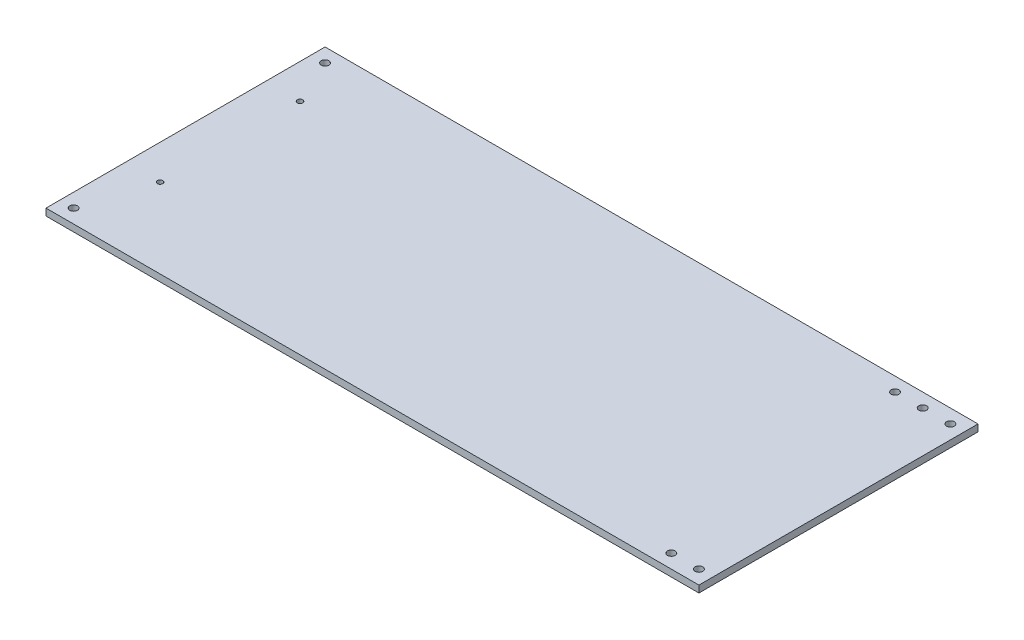
from build123d import *

# Parameters (mm, degrees)
BOSS_EXTRUDE1_START              = 19.05
SKETCH2_W                        = 600
SKETCH2_H                        = 256.45
BOSS_EXTRUDE1_DEPTH              = 6.35
BOSS_EXTRUDE2_START              = 19.05
SKETCH2_4_W                      = 455.092
SKETCH2_4_H                      = 256.45
BOSS_EXTRUDE2_DEPTH              = 6.35
BOSS_EXTRUDE3_START              = 19.05
SKETCH2_5_W                      = 455.092
SKETCH2_5_H                      = 300
BOSS_EXTRUDE3_DEPTH              = 6.35
SKETCH8_W                        = 3.5687
SKETCH8_H                        = 6.35
F_1_4_CLEARANCE_HOLE2_AT_2_COUNT = 2
F_1_4_CLEARANCE_HOLE2_AT_2_PITCH = 231.05
F_1_4_CLEARANCE_HOLE2_AT_3_COUNT = 2
F_1_4_CLEARANCE_HOLE2_AT_3_PITCH = 595.822744195
F_1_4_CLEARANCE_HOLE2_AT_4_COUNT = 2
F_1_4_CLEARANCE_HOLE2_AT_4_PITCH = 619.31354135
F_1_4_CLEARANCE_HOLE2_AT_5_COUNT = 2
F_1_4_CLEARANCE_HOLE2_AT_5_PITCH = 523.8
F_1_4_CLEARANCE_HOLE2_AT_6_COUNT = 2
F_1_4_CLEARANCE_HOLE2_AT_6_PITCH = 549.2
F_1_4_CLEARANCE_HOLE2_AT_7_COUNT = 2
F_1_4_CLEARANCE_HOLE2_AT_7_PITCH = 574.6
SKETCH10_W                       = 3.5687
SKETCH10_H                       = 6.35
F_1_4_CLEARANCE_HOLE3_AT_2_COUNT = 2
F_1_4_CLEARANCE_HOLE3_AT_2_PITCH = 25.4
F_1_4_CLEARANCE_HOLE3_AT_3_COUNT = 2
F_1_4_CLEARANCE_HOLE3_AT_3_PITCH = 50.8
F_1_4_CLEARANCE_HOLE3_AT_4_COUNT = 2
F_1_4_CLEARANCE_HOLE3_AT_4_PITCH = 231.05
F_1_4_CLEARANCE_HOLE3_AT_5_COUNT = 2
F_1_4_CLEARANCE_HOLE3_AT_5_PITCH = 487.872234672
F_1_4_CLEARANCE_HOLE3_AT_6_COUNT = 2
F_1_4_CLEARANCE_HOLE3_AT_6_PITCH = 476.368698976
F_1_4_CLEARANCE_HOLE3_AT_7_COUNT = 2
F_1_4_CLEARANCE_HOLE3_AT_7_PITCH = 429.692
SKETCH12_W                       = 3.5687
SKETCH12_H                       = 6.35
F_1_4_CLEARANCE_HOLE4_AT_2_COUNT = 2
F_1_4_CLEARANCE_HOLE4_AT_2_PITCH = 25.4
F_1_4_CLEARANCE_HOLE4_AT_3_COUNT = 2
F_1_4_CLEARANCE_HOLE4_AT_3_PITCH = 249.2
F_1_4_CLEARANCE_HOLE4_AT_4_COUNT = 2
F_1_4_CLEARANCE_HOLE4_AT_4_PITCH = 496.725130091
F_1_4_CLEARANCE_HOLE4_AT_5_COUNT = 2
F_1_4_CLEARANCE_HOLE4_AT_5_PITCH = 429.692
F_1_4_CLEARANCE_HOLE4_AT_6_COUNT = 2
F_1_4_CLEARANCE_HOLE4_AT_6_PITCH = 430.442069115
SKETCH14_W                       = 2.4892
SKETCH14_H                       = 6.35
F_8_CLEARANCE_HOLE2_AT_2_COUNT   = 2
F_8_CLEARANCE_HOLE2_AT_2_PITCH   = 128.5875
SKETCH16_W                       = 2.4892
SKETCH16_H                       = 6.35
F_8_CLEARANCE_HOLE3_AT_2_COUNT   = 2
F_8_CLEARANCE_HOLE3_AT_2_PITCH   = 128.5875
SKETCH17_R                       = 3.5687
BOSS_EXTRUDE4_DEPTH              = 6.35
FILLET2_R                        = 6.35
SKETCH18_W                       = 152.4
SKETCH18_H                       = 25.4
SKETCH18_R                       = 3.5687
BOSS_EXTRUDE5_DEPTH              = 6.35
SKETCH19_W                       = 25.4
SKETCH19_H                       = 101.6
SKETCH19_R                       = 3.5687
BOSS_EXTRUDE6_DEPTH              = 6.35


with BuildPart() as part:
    # Sketch2 → Boss-Extrude1 (new body)
    with BuildSketch(Plane(origin=(0, 0, 0), x_dir=(1, 0, 0), z_dir=(0, 1, 0)).offset(BOSS_EXTRUDE1_START)):
        with Locations((0, 278.225)):
            Rectangle(SKETCH2_W, SKETCH2_H)
    extrude(amount=BOSS_EXTRUDE1_DEPTH)

    # Sketch8 → 1/4 Clearance Hole2 (revolve, cut)
    with BuildSketch(Plane(origin=(-287.3, 25.4, -393.75), x_dir=(0, 0, 1), z_dir=(1, 0, 0))):
        with Locations((1.78435, 3.175)):
            Rectangle(SKETCH8_W, SKETCH8_H)
    f_1_4_clearance_hole2 = revolve(axis=Axis((-287.3, 31.75, -393.75), (0, -1, 0)), mode=Mode.SUBTRACT)

    # 1/4 Clearance Hole2 at 2: 1/4 Clearance Hole2 ×2
    with Locations(*[(0, 0, i * F_1_4_CLEARANCE_HOLE2_AT_2_PITCH) for i in range(1, F_1_4_CLEARANCE_HOLE2_AT_2_COUNT)]):
        add(f_1_4_clearance_hole2, mode=Mode.SUBTRACT)

    # 1/4 Clearance Hole2 at 3: 1/4 Clearance Hole2 ×2
    with Locations(*[Vector(0.9217506470687957, 0, 0.3877831154501913) * (i * F_1_4_CLEARANCE_HOLE2_AT_3_PITCH) for i in range(1, F_1_4_CLEARANCE_HOLE2_AT_3_COUNT)]):
        add(f_1_4_clearance_hole2, mode=Mode.SUBTRACT)

    # 1/4 Clearance Hole2 at 4: 1/4 Clearance Hole2 ×2
    with Locations(*[Vector(0.9278014473041833, 0, 0.37307435502894426) * (i * F_1_4_CLEARANCE_HOLE2_AT_4_PITCH) for i in range(1, F_1_4_CLEARANCE_HOLE2_AT_4_COUNT)]):
        add(f_1_4_clearance_hole2, mode=Mode.SUBTRACT)

    # 1/4 Clearance Hole2 at 5: 1/4 Clearance Hole2 ×2
    with Locations(*[(i * F_1_4_CLEARANCE_HOLE2_AT_5_PITCH, 0, 0) for i in range(1, F_1_4_CLEARANCE_HOLE2_AT_5_COUNT)]):
        add(f_1_4_clearance_hole2, mode=Mode.SUBTRACT)

    # 1/4 Clearance Hole2 at 6: 1/4 Clearance Hole2 ×2
    with Locations(*[(i * F_1_4_CLEARANCE_HOLE2_AT_6_PITCH, 0, 0) for i in range(1, F_1_4_CLEARANCE_HOLE2_AT_6_COUNT)]):
        add(f_1_4_clearance_hole2, mode=Mode.SUBTRACT)

    # 1/4 Clearance Hole2 at 7: 1/4 Clearance Hole2 ×2
    with Locations(*[(i * F_1_4_CLEARANCE_HOLE2_AT_7_PITCH, 0, 0) for i in range(1, F_1_4_CLEARANCE_HOLE2_AT_7_COUNT)]):
        add(f_1_4_clearance_hole2, mode=Mode.SUBTRACT)

    # Sketch14 → #8 Clearance Hole2 (revolve, cut)
    with BuildSketch(Plane(origin=(-268.25, 25.4, -351.68125), x_dir=(0, 0, 1), z_dir=(1, 0, 0))):
        with Locations((1.2446, 3.175)):
            Rectangle(SKETCH14_W, SKETCH14_H)
    f_8_clearance_hole2 = revolve(axis=Axis((-268.25, 31.75, -351.68125), (0, -1, 0)), mode=Mode.SUBTRACT)

    # #8 Clearance Hole2 at 2: #8 Clearance Hole2 ×2
    with Locations(*[(0, 0, i * F_8_CLEARANCE_HOLE2_AT_2_PITCH) for i in range(1, F_8_CLEARANCE_HOLE2_AT_2_COUNT)]):
        add(f_8_clearance_hole2, mode=Mode.SUBTRACT)


with BuildPart() as body_2:
    # Sketch2<4> → Boss-Extrude2 (new body)
    with BuildSketch(Plane(origin=(0, 0, 0), x_dir=(1, 0, 0), z_dir=(0, 1, 0)).offset(BOSS_EXTRUDE2_START)):
        with Locations((527.546, 278.225)):
            Rectangle(SKETCH2_4_W, SKETCH2_4_H)
    extrude(amount=BOSS_EXTRUDE2_DEPTH)

    # Sketch10 → 1/4 Clearance Hole3 (revolve, cut)
    with BuildSketch(Plane(origin=(312.7, 25.4, -393.75), x_dir=(0, 0, 1), z_dir=(1, 0, 0))):
        with Locations((1.78435, 3.175)):
            Rectangle(SKETCH10_W, SKETCH10_H)
    f_1_4_clearance_hole3 = revolve(axis=Axis((312.7, 31.75, -393.75), (0, -1, 0)), mode=Mode.SUBTRACT)

    # 1/4 Clearance Hole3 at 2: 1/4 Clearance Hole3 ×2
    with Locations(*[(i * F_1_4_CLEARANCE_HOLE3_AT_2_PITCH, 0, 0) for i in range(1, F_1_4_CLEARANCE_HOLE3_AT_2_COUNT)]):
        add(f_1_4_clearance_hole3, mode=Mode.SUBTRACT)

    # 1/4 Clearance Hole3 at 3: 1/4 Clearance Hole3 ×2
    with Locations(*[(i * F_1_4_CLEARANCE_HOLE3_AT_3_PITCH, 0, 0) for i in range(1, F_1_4_CLEARANCE_HOLE3_AT_3_COUNT)]):
        add(f_1_4_clearance_hole3, mode=Mode.SUBTRACT)

    # 1/4 Clearance Hole3 at 4: 1/4 Clearance Hole3 ×2
    with Locations(*[(0, 0, i * F_1_4_CLEARANCE_HOLE3_AT_4_PITCH) for i in range(1, F_1_4_CLEARANCE_HOLE3_AT_4_COUNT)]):
        add(f_1_4_clearance_hole3, mode=Mode.SUBTRACT)

    # 1/4 Clearance Hole3 at 5: 1/4 Clearance Hole3 ×2
    with Locations(*[Vector(0.880746985506873, 0, 0.47358710658183684) * (i * F_1_4_CLEARANCE_HOLE3_AT_5_PITCH) for i in range(1, F_1_4_CLEARANCE_HOLE3_AT_5_COUNT)]):
        add(f_1_4_clearance_hole3, mode=Mode.SUBTRACT)

    # 1/4 Clearance Hole3 at 6: 1/4 Clearance Hole3 ×2
    with Locations(*[Vector(0.9020156045595491, 0, 0.4317034272866863) * (i * F_1_4_CLEARANCE_HOLE3_AT_6_PITCH) for i in range(1, F_1_4_CLEARANCE_HOLE3_AT_6_COUNT)]):
        add(f_1_4_clearance_hole3, mode=Mode.SUBTRACT)

    # 1/4 Clearance Hole3 at 7: 1/4 Clearance Hole3 ×2
    with Locations(*[(i * F_1_4_CLEARANCE_HOLE3_AT_7_PITCH, 0, 0) for i in range(1, F_1_4_CLEARANCE_HOLE3_AT_7_COUNT)]):
        add(f_1_4_clearance_hole3, mode=Mode.SUBTRACT)

    # Sketch16 → #8 Clearance Hole3 (revolve, cut)
    with BuildSketch(Plane(origin=(723.342, 25.4, -351.68125), x_dir=(0, 0, 1), z_dir=(1, 0, 0))):
        with Locations((1.2446, 3.175)):
            Rectangle(SKETCH16_W, SKETCH16_H)
    f_8_clearance_hole3 = revolve(axis=Axis((723.342, 31.75, -351.68125), (0, -1, 0)), mode=Mode.SUBTRACT)

    # #8 Clearance Hole3 at 2: #8 Clearance Hole3 ×2
    with Locations(*[(0, 0, i * F_8_CLEARANCE_HOLE3_AT_2_PITCH) for i in range(1, F_8_CLEARANCE_HOLE3_AT_2_COUNT)]):
        add(f_8_clearance_hole3, mode=Mode.SUBTRACT)


with BuildPart() as body_3:
    # Sketch2<5> → Boss-Extrude3 (new body)
    with BuildSketch(Plane(origin=(0, 0, 0), x_dir=(1, 0, 0), z_dir=(0, 1, 0)).offset(BOSS_EXTRUDE3_START)):
        with Locations((527.546, 0)):
            Rectangle(SKETCH2_5_W, SKETCH2_5_H)
    extrude(amount=BOSS_EXTRUDE3_DEPTH)

    # Sketch12 → 1/4 Clearance Hole4 (revolve, cut)
    with BuildSketch(Plane(origin=(312.7, 25.4, -111.9), x_dir=(0, 0, 1), z_dir=(1, 0, 0))):
        with Locations((1.78435, 3.175)):
            Rectangle(SKETCH12_W, SKETCH12_H)
    f_1_4_clearance_hole4 = revolve(axis=Axis((312.7, 31.75, -111.9), (0, -1, 0)), mode=Mode.SUBTRACT)

    # 1/4 Clearance Hole4 at 2: 1/4 Clearance Hole4 ×2
    with Locations(*[(0, 0, -i * F_1_4_CLEARANCE_HOLE4_AT_2_PITCH) for i in range(1, F_1_4_CLEARANCE_HOLE4_AT_2_COUNT)]):
        add(f_1_4_clearance_hole4, mode=Mode.SUBTRACT)

    # 1/4 Clearance Hole4 at 3: 1/4 Clearance Hole4 ×2
    with Locations(*[(0, 0, i * F_1_4_CLEARANCE_HOLE4_AT_3_PITCH) for i in range(1, F_1_4_CLEARANCE_HOLE4_AT_3_COUNT)]):
        add(f_1_4_clearance_hole4, mode=Mode.SUBTRACT)

    # 1/4 Clearance Hole4 at 4: 1/4 Clearance Hole4 ×2
    with Locations(*[Vector(0.865049851456502, 0, 0.5016859121951541) * (i * F_1_4_CLEARANCE_HOLE4_AT_4_PITCH) for i in range(1, F_1_4_CLEARANCE_HOLE4_AT_4_COUNT)]):
        add(f_1_4_clearance_hole4, mode=Mode.SUBTRACT)

    # 1/4 Clearance Hole4 at 5: 1/4 Clearance Hole4 ×2
    with Locations(*[(i * F_1_4_CLEARANCE_HOLE4_AT_5_PITCH, 0, 0) for i in range(1, F_1_4_CLEARANCE_HOLE4_AT_5_COUNT)]):
        add(f_1_4_clearance_hole4, mode=Mode.SUBTRACT)

    # 1/4 Clearance Hole4 at 6: 1/4 Clearance Hole4 ×2
    with Locations(*[Vector(0.998257444685787, 0, -0.05900910208944768) * (i * F_1_4_CLEARANCE_HOLE4_AT_6_PITCH) for i in range(1, F_1_4_CLEARANCE_HOLE4_AT_6_COUNT)]):
        add(f_1_4_clearance_hole4, mode=Mode.SUBTRACT)


with BuildPart() as body_4:
    # Sketch17 → Boss-Extrude4 (new body)
    with BuildSketch(Plane(origin=(0, 25.4, 0), x_dir=(1, 0, 0), z_dir=(0, 1, 0))):
        Polygon((249.2, 150), (249.2, 175.4), (325.4, 175.4), (325.4, 99.2), (300, 99.2), (300, 150), align=None)
        with Locations(Location((261.9, 162.7, 0), (0, 0, 270))):
            Circle(SKETCH17_R, mode=Mode.SUBTRACT)
        with Locations(Location((287.3, 162.7, 0), (0, 0, 270))):
            Circle(SKETCH17_R, mode=Mode.SUBTRACT)
        with Locations(Location((312.7, 162.7, 0), (0, 0, 270))):
            Circle(SKETCH17_R, mode=Mode.SUBTRACT)
        with Locations(Location((312.7, 137.3, 0), (0, 0, 270))):
            Circle(SKETCH17_R, mode=Mode.SUBTRACT)
        with Locations(Location((312.7, 111.9, 0), (0, 0, 270))):
            Circle(SKETCH17_R, mode=Mode.SUBTRACT)
    extrude(amount=BOSS_EXTRUDE4_DEPTH)

    # Fillet2
    fillet2_edges = [body_4.edges().sort_by_distance(p)[0] for p in [
        (249.2, 28.575, -150),
        (249.2, 28.575, -175.4),
        (325.4, 28.575, -175.4),
        (325.4, 28.575, -99.2),
        (300, 28.575, -99.2),
    ]]
    fillet(fillet2_edges, radius=FILLET2_R)


with BuildPart() as body_5:
    # Sketch18 → Boss-Extrude5 (new body)
    with BuildSketch(Plane(origin=(0, 25.4, 0), x_dir=(1, 0, 0), z_dir=(0, 1, 0))):
        with Locations((300, 393.75)):
            Rectangle(SKETCH18_W, SKETCH18_H)
        with Locations(Location((236.5, 393.75, 0), (0, 0, 270))):
            Circle(SKETCH18_R, mode=Mode.SUBTRACT)
        with Locations(Location((261.9, 393.75, 0), (0, 0, 270))):
            Circle(SKETCH18_R, mode=Mode.SUBTRACT)
        with Locations(Location((287.3, 393.75, 0), (0, 0, 270))):
            Circle(SKETCH18_R, mode=Mode.SUBTRACT)
        with Locations(Location((312.7, 393.75, 0), (0, 0, 270))):
            Circle(SKETCH18_R, mode=Mode.SUBTRACT)
        with Locations(Location((338.1, 393.75, 0), (0, 0, 270))):
            Circle(SKETCH18_R, mode=Mode.SUBTRACT)
        with Locations(Location((363.5, 393.75, 0), (0, 0, 270))):
            Circle(SKETCH18_R, mode=Mode.SUBTRACT)
    extrude(amount=BOSS_EXTRUDE5_DEPTH)


with BuildPart() as body_6:
    # Sketch19 → Boss-Extrude6 (new body)
    with BuildSketch(Plane(origin=(0, 25.4, 0), x_dir=(1, 0, 0), z_dir=(0, 1, 0))):
        with Locations((742.392, 150)):
            Rectangle(SKETCH19_W, SKETCH19_H)
        with Locations((742.392, 111.9)):
            Circle(SKETCH19_R, mode=Mode.SUBTRACT)
        with Locations((742.392, 137.3)):
            Circle(SKETCH19_R, mode=Mode.SUBTRACT)
        with Locations((742.392, 162.7)):
            Circle(SKETCH19_R, mode=Mode.SUBTRACT)
        with Locations((742.392, 188.1)):
            Circle(SKETCH19_R, mode=Mode.SUBTRACT)
    extrude(amount=BOSS_EXTRUDE6_DEPTH)


solid = part.part
